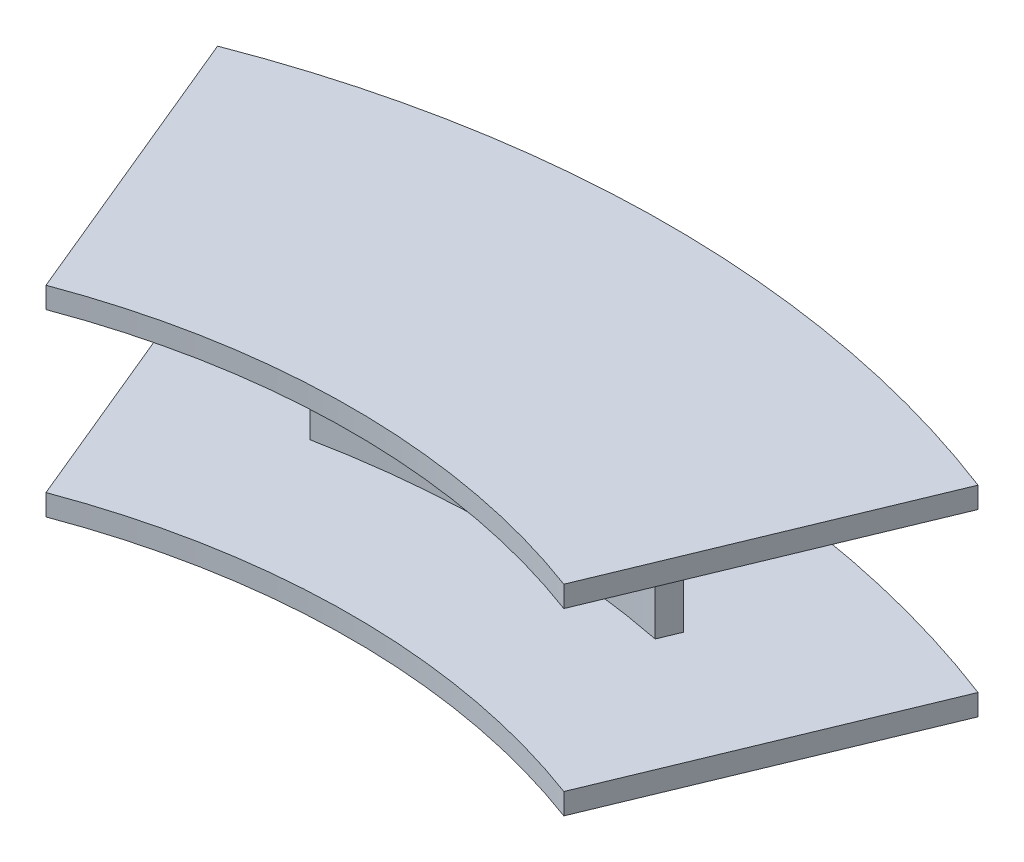
from build123d import *

# Parameters (mm, degrees)
BOSS_EXTRUDE1_DEPTH = 5
BOSS_EXTRUDE2_DEPTH = 75


with BuildPart() as part:
    # Sketch1 → Boss-Extrude1 (new, symmetric)
    with BuildSketch(Plane(origin=(0, 0, 0), x_dir=(1, 0, 0), z_dir=(0, 1, 0))):
        with BuildLine():
            Line((-180.222015843, 53.002628104), (-122.795016255, -85.638413146))
            ThreePointArc((-122.795016255, -85.638413146), (-0.222015843, -63.473523483), (122.35098457, -85.638413146))
            Line((122.35098457, -85.638413146), (179.777984157, 53.002628104))
            ThreePointArc((179.777984157, 53.002628104), (-0.222015843, 86.526476517), (-180.222015843, 53.002628104))
        make_face()
    boss_extrude1 = extrude(amount=BOSS_EXTRUDE1_DEPTH, both=True)

    # Sketch2 → Boss-Extrude2 (add)
    with BuildSketch(Plane(origin=(0, 5, 0), x_dir=(1, 0, 0), z_dir=(0, 1, 0))):
        with BuildLine():
            Line((-85.783992443, 7.927886292), (-81.883470475, -1.488806743))
            ThreePointArc((-81.883470475, -1.488806743), (-0.222015843, 6.526476517), (81.43943879, -1.488806743))
            Line((81.43943879, -1.488806743), (85.339960758, 7.927886292))
            ThreePointArc((85.339960758, 7.927886292), (-0.222015843, 16.526476517), (-85.783992443, 7.927886292))
        make_face()
    extrude(amount=BOSS_EXTRUDE2_DEPTH)

    # Mirror1: Boss-Extrude1 across plane
    add(boss_extrude1.mirror(Plane.ZX.offset(42.5)))


solid = part.part
